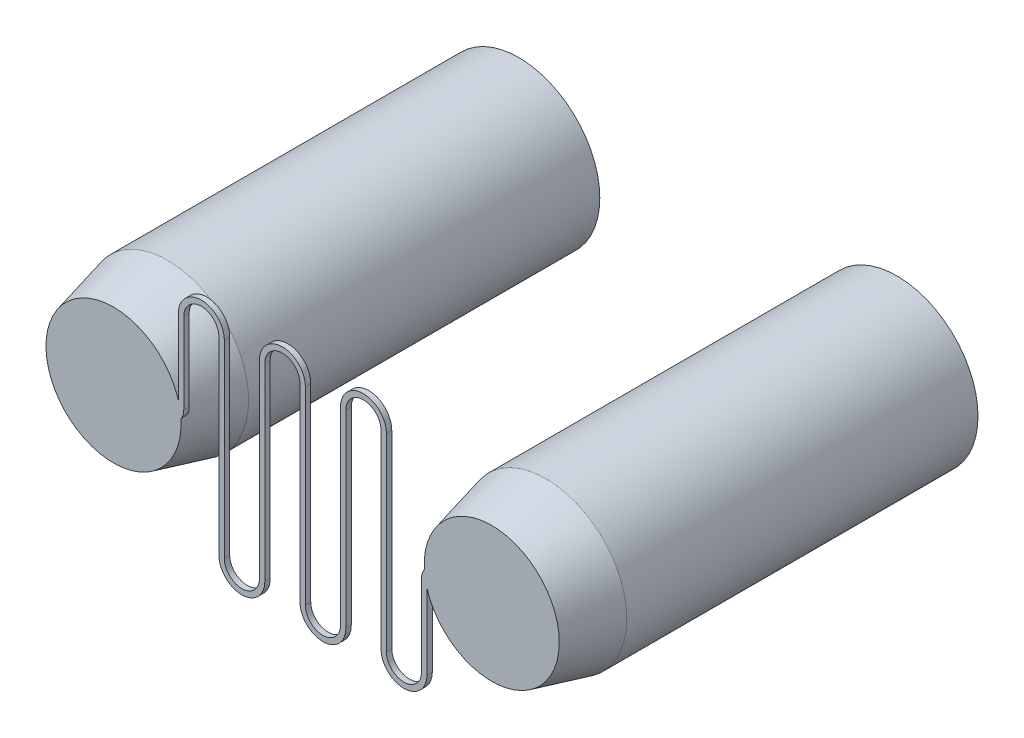
from build123d import *
from build123d.topology import SkipClean

# Parameters (mm, degrees)
BOSS_EXTRUDE1_DEPTH = 0.4


with BuildPart() as part:
    # Sketch2 → Boss-Extrude1 (new body)
    with BuildSketch(Plane.XY):
        with BuildLine():
            Line((-17.5, -0.2), (-13.5, -0.2))
            ThreePointArc((-13.5, -0.2), (-12.651471863, 0.151471863), (-12.3, 1))
            Line((-12.3, 1), (-12.3, 7))
            ThreePointArc((-12.3, 7), (-11, 8.3), (-9.7, 7))
            Line((-9.7, 7), (-9.7, 0))
            Line((-9.7, 0), (-9.7, -7))
            ThreePointArc((-9.7, -7), (-8, -8.7), (-6.3, -7))
            Line((-6.3, -7), (-6.3, 0))
            Line((-6.3, 0), (-6.3, 7))
            ThreePointArc((-6.3, 7), (-5, 8.3), (-3.7, 7))
            Line((-3.7, 7), (-3.7, 0))
            Line((-3.7, 0), (-3.7, -7))
            ThreePointArc((-3.7, -7), (-2, -8.7), (-0.3, -7))
            Line((-0.3, -7), (-0.3, 0))
            Line((-0.3, 0), (-0.3, 7))
            ThreePointArc((-0.3, 7), (1, 8.3), (2.3, 7))
            Line((2.3, 7), (2.3, 0))
            Line((2.3, 0), (2.3, -7))
            ThreePointArc((2.3, -7), (4, -8.7), (5.7, -7))
            Line((5.7, -7), (5.7, -1))
            ThreePointArc((5.7, -1), (5.934314575, -0.434314575), (6.5, -0.2))
            Line((6.5, -0.2), (10.5, -0.2))
            ThreePointArc((10.5, -0.2), (10.7, 0), (10.5, 0.2))
            Line((10.5, 0.2), (6.5, 0.2))
            ThreePointArc((6.5, 0.2), (5.651471863, -0.151471863), (5.3, -1))
            Line((5.3, -1), (5.3, -7))
            ThreePointArc((5.3, -7), (4, -8.3), (2.7, -7))
            Line((2.7, -7), (2.7, 0))
            Line((2.7, 0), (2.7, 7))
            ThreePointArc((2.7, 7), (1, 8.7), (-0.7, 7))
            Line((-0.7, 7), (-0.7, 0))
            Line((-0.7, 0), (-0.7, -7))
            ThreePointArc((-0.7, -7), (-2, -8.3), (-3.3, -7))
            Line((-3.3, -7), (-3.3, 0))
            Line((-3.3, 0), (-3.3, 7))
            ThreePointArc((-3.3, 7), (-5, 8.7), (-6.7, 7))
            Line((-6.7, 7), (-6.7, 0))
            Line((-6.7, 0), (-6.7, -7))
            ThreePointArc((-6.7, -7), (-8, -8.3), (-9.3, -7))
            Line((-9.3, -7), (-9.3, 0))
            Line((-9.3, 0), (-9.3, 7))
            ThreePointArc((-9.3, 7), (-11, 8.7), (-12.7, 7))
            Line((-12.7, 7), (-12.7, 1))
            ThreePointArc((-12.7, 1), (-12.934314575, 0.434314575), (-13.5, 0.2))
            Line((-13.5, 0.2), (-17.5, 0.2))
            ThreePointArc((-17.5, 0.2), (-17.7, 0), (-17.5, -0.2))
        make_face()
    extrude(amount=BOSS_EXTRUDE1_DEPTH)

    # Sketch3 → Revolve1 (revolve)
    with SkipClean():  # the faces are left unmerged after this step: merging them gives an invalid solid
        with BuildSketch(Plane(origin=(0, 0, 0), x_dir=(-1, 0, 0), z_dir=(0, -1, 0)), mode=Mode.PRIVATE) as revolve1_sk:
            Polygon((17.5, -0.4), (22.5, -0.4), (23.5, 3.6), (23.5, 29.6), (17.5, 29.6), align=None)
        revolve(revolve1_sk.sketch.rotate(Axis((-17.5, 0, 0.4), (0, 0, -1)), 160.250078189), axis=Axis((-17.5, 0, 0.4), (0, 0, -1)))

    # Sketch4 → Revolve2 (revolve)
    with SkipClean():  # the faces are left unmerged after this step: merging them gives an invalid solid
        with BuildSketch(Plane(origin=(0, 0, 0), x_dir=(-1, 0, 0), z_dir=(0, -1, 0)), mode=Mode.PRIVATE) as revolve2_sk:
            Polygon((-10.5, -0.4), (-15.5, -0.4), (-16.5, 3.6), (-16.5, 29.6), (-10.5, 29.6), align=None)
        revolve(revolve2_sk.sketch.rotate(Axis((10.5, 0, 0.4), (0, 0, -1)), 176.315074658), axis=Axis((10.5, 0, 0.4), (0, 0, -1)))


solid = part.part
